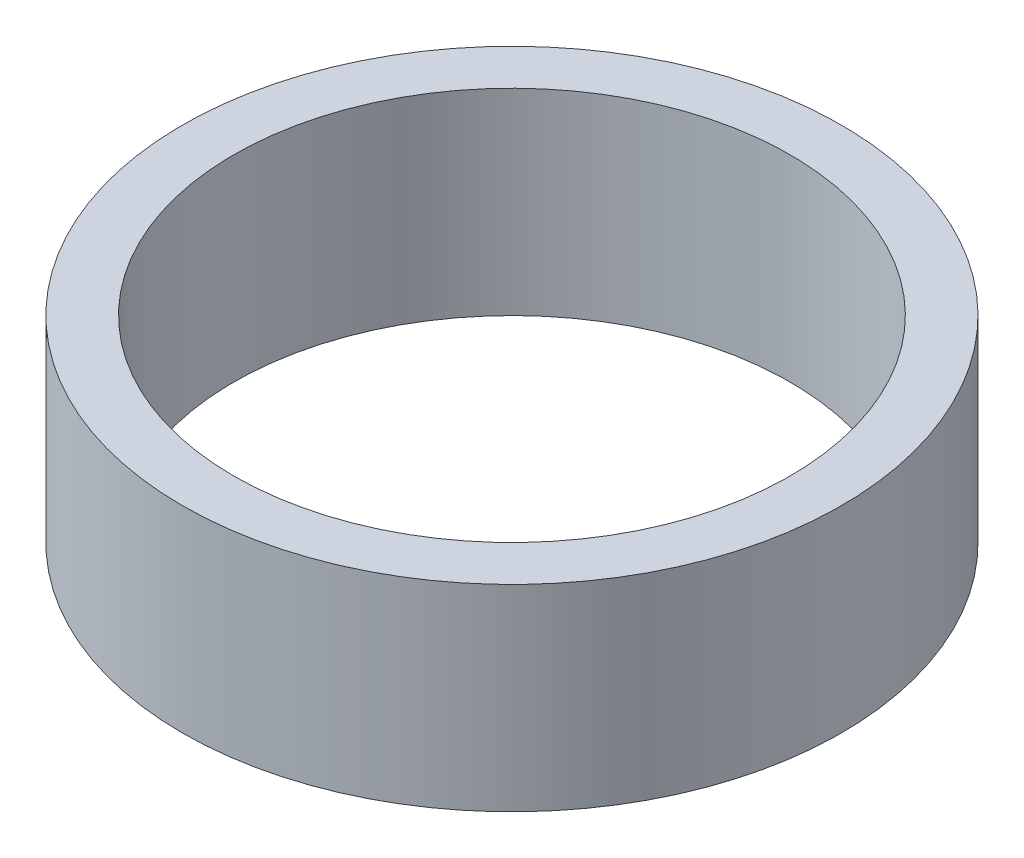
from build123d import *

# Parameters (mm, degrees)
ESQUISSE1_R        = 3.85
ESQUISSE1_R_2      = 3.25
BOSS_EXTRU_1_DEPTH = 2.3


with BuildPart() as part:
    # Esquisse1 → Boss.-Extru.1 (new body)
    with BuildSketch(Plane(origin=(0, 0, 0), x_dir=(1, 0, 0), z_dir=(0, 1, 0))):
        with Locations(Location((0, 0, 0), (0, 0, 270))):
            Circle(ESQUISSE1_R)
        with Locations(Location((0, 0, 0), (0, 0, 270))):
            Circle(ESQUISSE1_R_2, mode=Mode.SUBTRACT)
    extrude(amount=BOSS_EXTRU_1_DEPTH)


solid = part.part
